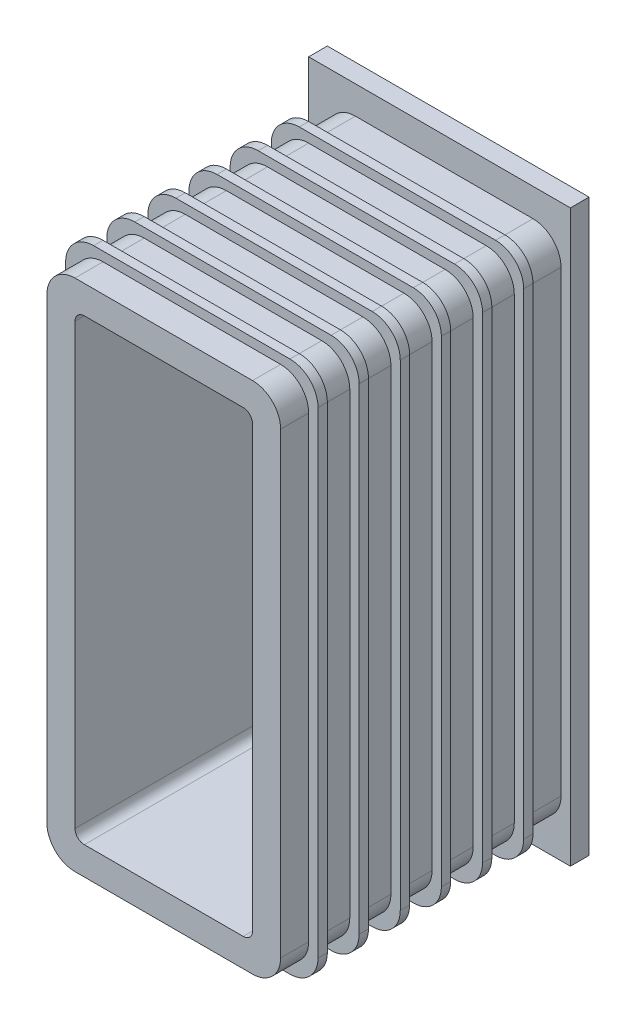
from build123d import *

# Parameters (mm, degrees)
SKETCH2_W           = 50
SKETCH2_H           = 225
SKETCH2_W_2         = 30
SKETCH2_H_2         = 205
BOSS_EXTRUDE1_DEPTH = 25
SKETCH3_W           = 140
SKETCH3_H           = 305
SKETCH3_W_2         = 30
SKETCH3_H_2         = 205
BOSS_EXTRUDE2_DEPTH = 10
BOSS_EXTRUDE3_DEPTH = 150
BOSS_EXTRUDE4_START = 20
BOSS_EXTRUDE4_DEPTH = 5
LPATTERN1_COUNT     = 6
LPATTERN1_PITCH     = 22


with BuildPart() as part:
    # Sketch2 → Boss-Extrude1 (new body)
    with BuildSketch(Plane.XY):
        Rectangle(SKETCH2_W, SKETCH2_H)
        Rectangle(SKETCH2_W_2, SKETCH2_H_2, mode=Mode.SUBTRACT)
    extrude(amount=-BOSS_EXTRUDE1_DEPTH)

    # Sketch3 → Boss-Extrude2 (add)
    with BuildSketch(Plane.XY):
        with Locations((15, 0)):
            Rectangle(SKETCH3_W, SKETCH3_H)
        Rectangle(SKETCH3_W_2, SKETCH3_H_2, mode=Mode.SUBTRACT)
    extrude(amount=BOSS_EXTRUDE2_DEPTH)

    # Sketch4 → Boss-Extrude3 (add)
    with BuildSketch(Plane.XY.offset(10)):
        with BuildLine():
            Line((-30, 137.5), (65, 137.5))
            ThreePointArc((65, 137.5), (75.606601718, 133.106601718), (80, 122.5))
            Line((80, 122.5), (80, -122.5))
            ThreePointArc((80, -122.5), (75.606601718, -133.106601718), (65, -137.5))
            Line((65, -137.5), (-30, -137.5))
            ThreePointArc((-30, -137.5), (-40.606601718, -133.106601718), (-45, -122.5))
            Line((-45, -122.5), (-45, 122.5))
            ThreePointArc((-45, 122.5), (-40.606601718, 133.106601718), (-30, 137.5))
        make_face()
        with BuildLine():
            Line((-25, 122.5), (60, 122.5))
            ThreePointArc((60, 122.5), (63.535533906, 121.035533906), (65, 117.5))
            Line((65, 117.5), (65, -117.5))
            ThreePointArc((65, -117.5), (63.535533906, -121.035533906), (60, -122.5))
            Line((60, -122.5), (-25, -122.5))
            ThreePointArc((-25, -122.5), (-28.535533906, -121.035533906), (-30, -117.5))
            Line((-30, -117.5), (-30, 117.5))
            ThreePointArc((-30, 117.5), (-28.535533906, 121.035533906), (-25, 122.5))
        make_face(mode=Mode.SUBTRACT)
    extrude(amount=BOSS_EXTRUDE3_DEPTH)

    # Sketch5 → Boss-Extrude4 (add)
    with BuildSketch(Plane.XY.offset(10).offset(BOSS_EXTRUDE4_START)):
        with BuildLine():
            Line((-35, 142.5), (70, 142.5))
            ThreePointArc((70, 142.5), (80.606601718, 138.106601718), (85, 127.5))
            Line((85, 127.5), (85, -127.5))
            ThreePointArc((85, -127.5), (80.606601718, -138.106601718), (70, -142.5))
            Line((70, -142.5), (-35, -142.5))
            ThreePointArc((-35, -142.5), (-45.606601718, -138.106601718), (-50, -127.5))
            Line((-50, -127.5), (-50, 127.5))
            ThreePointArc((-50, 127.5), (-45.606601718, 138.106601718), (-35, 142.5))
        make_face()
        with BuildLine():
            Line((-30, 137.5), (65, 137.5))
            ThreePointArc((65, 137.5), (75.606601718, 133.106601718), (80, 122.5))
            Line((80, 122.5), (80, -122.5))
            ThreePointArc((80, -122.5), (75.606601718, -133.106601718), (65, -137.5))
            Line((65, -137.5), (-30, -137.5))
            ThreePointArc((-30, -137.5), (-40.606601718, -133.106601718), (-45, -122.5))
            Line((-45, -122.5), (-45, 122.5))
            ThreePointArc((-45, 122.5), (-40.606601718, 133.106601718), (-30, 137.5))
        make_face(mode=Mode.SUBTRACT)
    boss_extrude4 = extrude(amount=BOSS_EXTRUDE4_DEPTH)

    # LPattern1: Boss-Extrude4 ×6
    with Locations(*[(0, 0, i * LPATTERN1_PITCH) for i in range(1, LPATTERN1_COUNT)]):
        add(boss_extrude4)


solid = part.part
